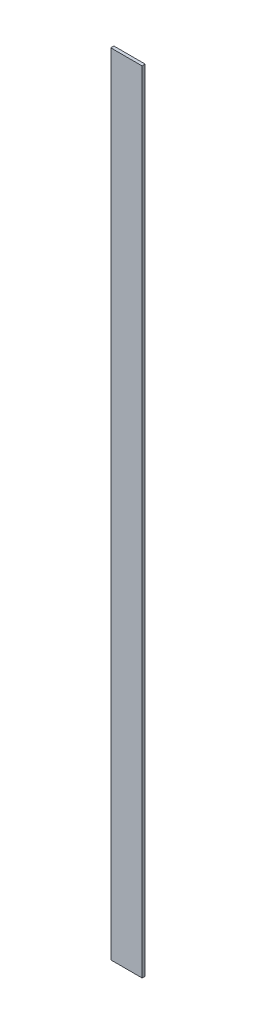
from build123d import *

# Parameters (mm, degrees)
REAR_WALL_STIFFENING_LIP_PROFILE_W = 10
REAR_WALL_STIFFENING_LIP_PROFILE_H = 252
REAR_WALL_STIFFENING_LIP_DEPTH     = 1


with BuildPart() as part:
    # Rear wall stiffening lip profile → Rear wall stiffening lip (new body)
    with BuildSketch(Plane.XY):
        with Locations((-134, 0)):
            Rectangle(REAR_WALL_STIFFENING_LIP_PROFILE_W, REAR_WALL_STIFFENING_LIP_PROFILE_H)
    extrude(amount=REAR_WALL_STIFFENING_LIP_DEPTH)


solid = part.part
